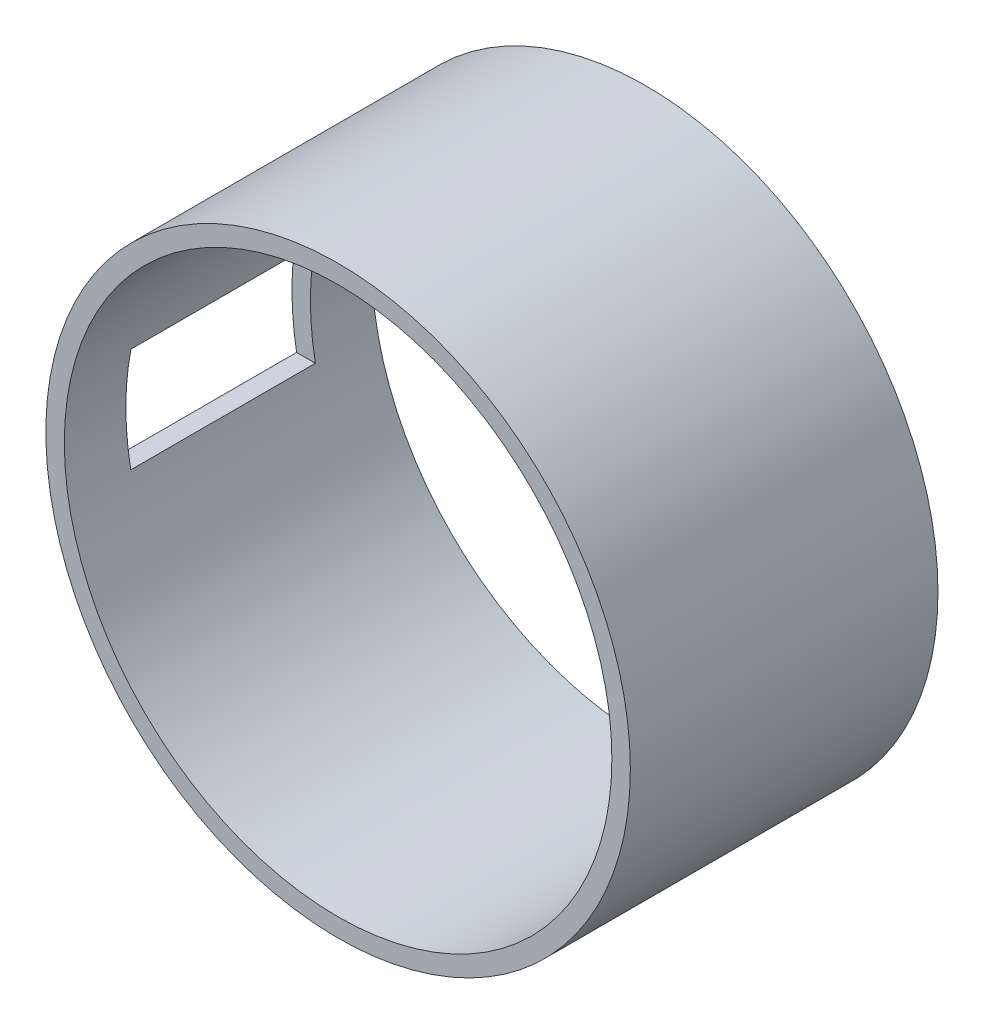
from build123d import *

# Parameters (mm, degrees)
SKETCH_1_R          = 9.5
SKETCH_1_R_2        = 8.9
EXTRUDE_1_DEPTH     = 10
SKETCH_3_W          = 6
SKETCH_3_H          = 3.4
CUT_EXTRUDE_1_DEPTH = 1.5


with BuildPart() as part:
    # 草图1 → 凸台-拉伸1 (new body)
    with BuildSketch(Plane.XY):
        Circle(SKETCH_1_R)
        Circle(SKETCH_1_R_2, mode=Mode.SUBTRACT)
    extrude(amount=EXTRUDE_1_DEPTH)

    # 草图3 → 切除-拉伸1 (cut)
    with BuildSketch(Plane.ZY.offset(9.5)):
        with Locations((5, 0.014841624)):
            Rectangle(SKETCH_3_W, SKETCH_3_H)
    extrude(amount=-CUT_EXTRUDE_1_DEPTH, mode=Mode.SUBTRACT)


solid = part.part
